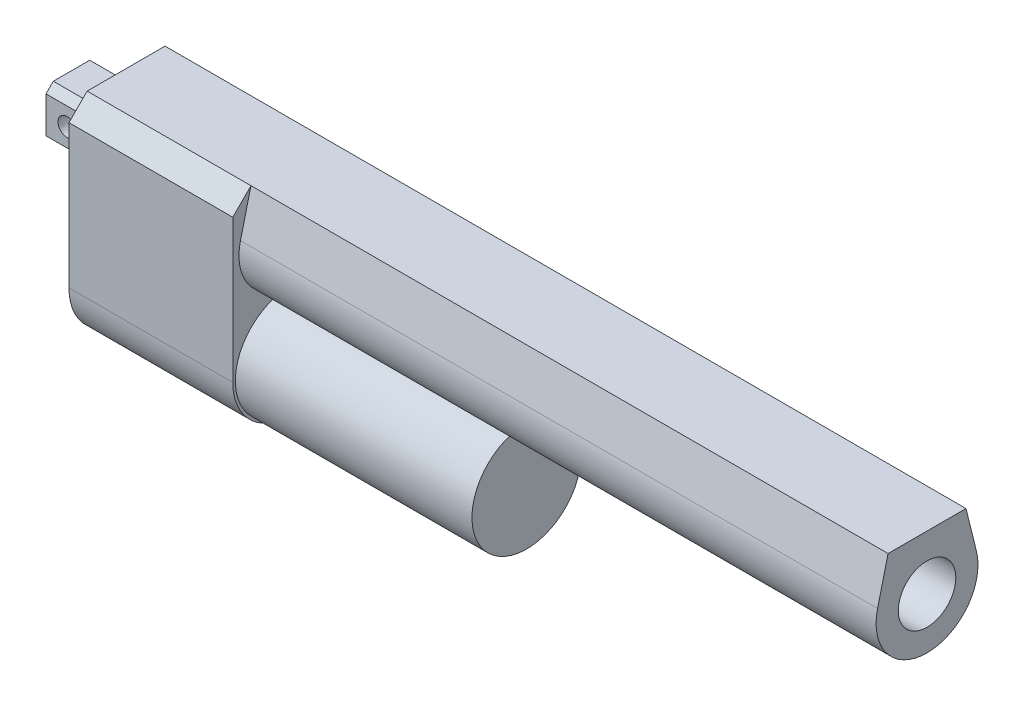
from build123d import *

# Parameters (mm, degrees)
BOSS_EXTRUDE1_DEPTH = 57.15
SKETCH2_R           = 19.05
BOSS_EXTRUDE2_DEPTH = 82.55
BOSS_EXTRUDE3_DEPTH = 19.05
SKETCH4_R           = 3.175
CUT_EXTRUDE1_DEPTH  = 154.666273922
BOSS_EXTRUDE4_DEPTH = 222.25
SKETCH6_R           = 10.033
CUT_EXTRUDE2_DEPTH  = 203.2


with BuildPart() as part:
    # Sketch1 → Boss-Extrude1 (new body)
    with BuildSketch(Plane(origin=(0, 0, 0), x_dir=(0, 0, -1), z_dir=(1, 0, 0))):
        with BuildLine():
            Line((-13.589, 19.05), (13.589, 19.05))
            Line((13.589, 19.05), (19.939, 12.7))
            Line((19.939, 12.7), (19.939, -37.211))
            ThreePointArc((19.939, -37.211), (0, -57.15), (-19.939, -37.211))
            Line((-19.939, -37.211), (-19.939, 12.7))
            Line((-19.939, 12.7), (-13.589, 19.05))
        make_face()
    extrude(amount=BOSS_EXTRUDE1_DEPTH)

    # Sketch2 → Boss-Extrude2 (add)
    with BuildSketch(Plane(origin=(57.15, 0, 0), x_dir=(0, 0, -1), z_dir=(1, 0, 0))):
        with Locations((0, -37.211)):
            Circle(SKETCH2_R)
    extrude(amount=BOSS_EXTRUDE2_DEPTH)

    # Sketch3 → Boss-Extrude3 (add)
    with BuildSketch(Plane.ZY):
        Polygon((-6.35, 8.89), (6.35, 8.89), (8.89, 6.35), (8.89, -6.35), (6.35, -8.89), (-6.35, -8.89), (-8.89, -6.35), (-8.89, 6.35), align=None)
    extrude(amount=BOSS_EXTRUDE3_DEPTH)

    # Sketch4 → Cut-Extrude1 (cut, through all)
    with BuildSketch(Plane.XY.offset(8.89)):
        with Locations((-11.684, 0)):
            Circle(SKETCH4_R)
    extrude(amount=-CUT_EXTRUDE1_DEPTH, mode=Mode.SUBTRACT)

    # Sketch5 → Boss-Extrude4 (add)
    with BuildSketch(Plane(origin=(57.15, 0, 0), x_dir=(0, 0, -1), z_dir=(1, 0, 0))):
        with BuildLine():
            Line((-13.589, 19.05), (13.589, 19.05))
            Line((13.589, 19.05), (17.255800165, 4.285529215))
            ThreePointArc((17.255800165, 4.285529215), (0, -17.78), (-17.255800165, 4.285529215))
            Line((-17.255800165, 4.285529215), (-13.589, 19.05))
        make_face()
    extrude(amount=BOSS_EXTRUDE4_DEPTH)

    # Sketch6 → Cut-Extrude2 (cut)
    with BuildSketch(Plane(origin=(279.4, 0, 0), x_dir=(0, 0, -1), z_dir=(1, 0, 0))):
        Circle(SKETCH6_R)
    extrude(amount=-CUT_EXTRUDE2_DEPTH, mode=Mode.SUBTRACT)


solid = part.part
